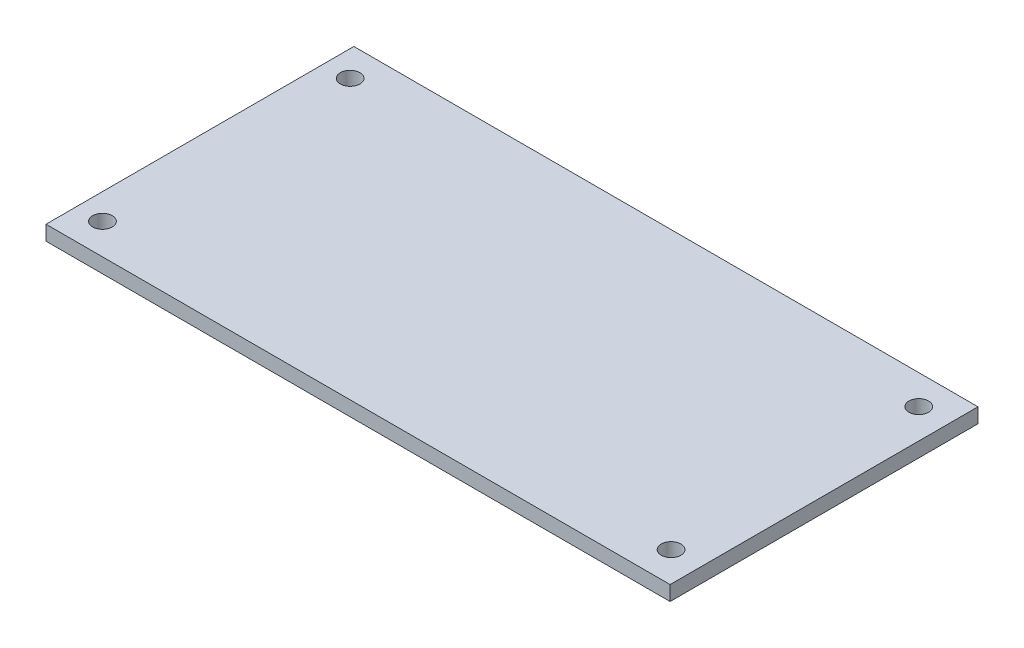
from build123d import *

# Parameters (mm, degrees)
SKETCH1_W           = 127.2
SKETCH1_H           = 62.75
SKETCH1_R           = 1.99999854
BOSS_EXTRUDE1_DEPTH = 3


with BuildPart() as part:
    # Sketch1 → Boss-Extrude1 (new body)
    with BuildSketch(Plane(origin=(0, 0, 0), x_dir=(1, 0, 0), z_dir=(0, 1, 0))):
        Rectangle(SKETCH1_W, SKETCH1_H)
        with Locations(Location((57.531, 25.36825, 0), (0, 0, 270))):
            Circle(SKETCH1_R, mode=Mode.SUBTRACT)
        with Locations(Location((57.531, -25.11425, 0), (0, 0, 270))):
            Circle(SKETCH1_R, mode=Mode.SUBTRACT)
        with Locations(Location((-58.3565, -25.11425, 0), (0, 0, 270))):
            Circle(SKETCH1_R, mode=Mode.SUBTRACT)
        with Locations(Location((-58.3565, 25.36825, 0), (0, 0, 270))):
            Circle(SKETCH1_R, mode=Mode.SUBTRACT)
    extrude(amount=BOSS_EXTRUDE1_DEPTH)


solid = part.part
